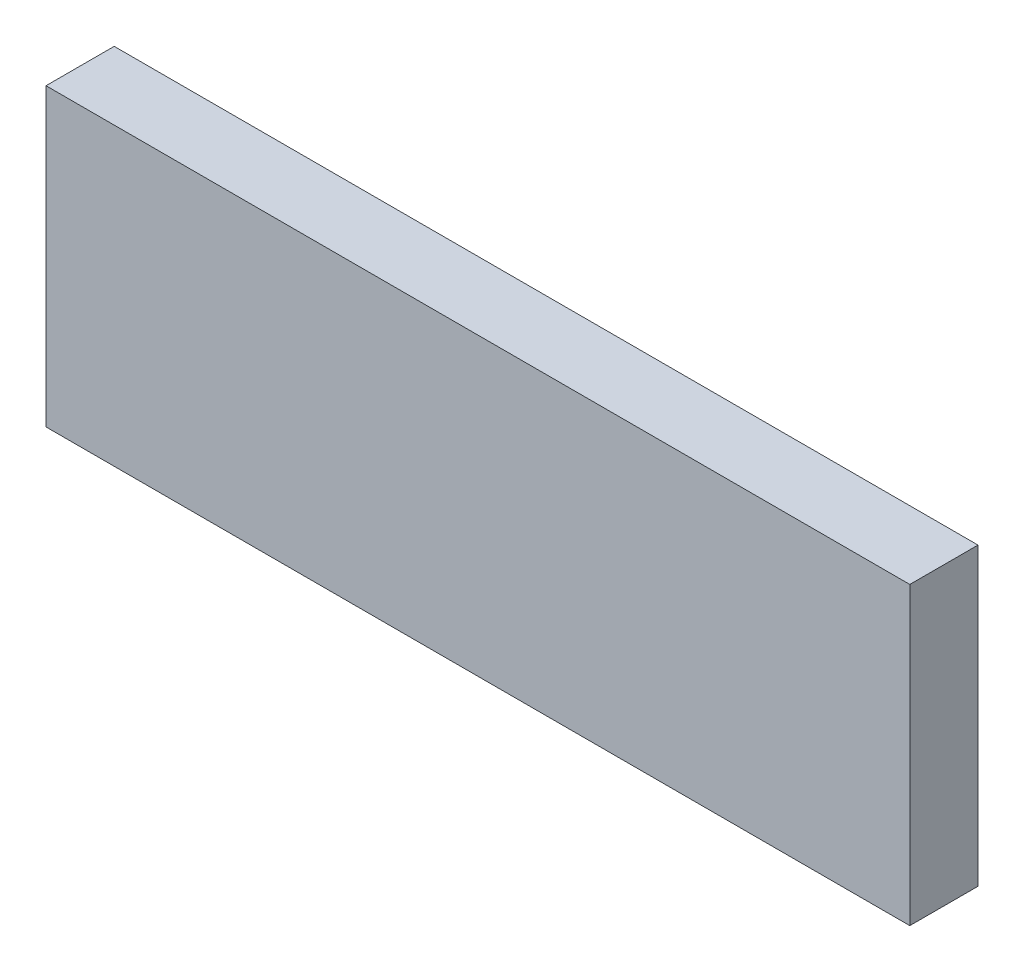
from build123d import *

# Parameters (mm, degrees)
SKETCH_1_W      = 38
SKETCH_1_H      = 13
EXTRUDE_1_DEPTH = 3


with BuildPart() as part:
    # 草图1 → 凸台-拉伸1 (new body)
    with BuildSketch(Plane.XY):
        with Locations((-44.228247887, 25.848980113)):
            Rectangle(SKETCH_1_W, SKETCH_1_H)
    extrude(amount=EXTRUDE_1_DEPTH)


solid = part.part
